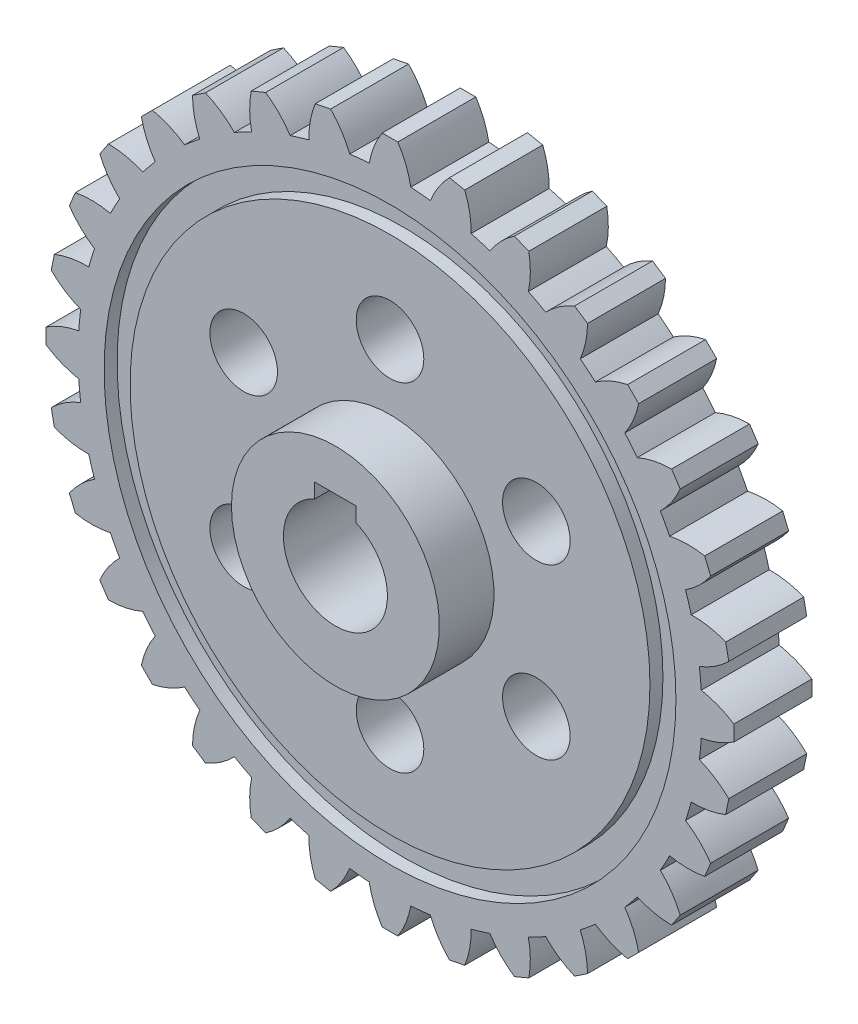
from build123d import *

# Parameters (mm, degrees)
SKETCH1_R           = 60
BOSS_EXTRUDE1_DEPTH = 15
SKETCH2_R           = 6.5
CUT_EXTRUDE1_DEPTH  = 87.168439698
SKETCH3_R           = 20
BOSS_EXTRUDE2_DEPTH = 10.5
CUT_EXTRUDE2_DEPTH  = 89.601636554
SKETCH5_R           = 55
SKETCH5_R_2         = 50
CUT_EXTRUDE3_DEPTH  = 2.5
BOSS_EXTRUDE3_START = -15
BOSS_EXTRUDE3_DEPTH = 15


with BuildPart() as part:
    # Sketch1 → Boss-Extrude1 (new body)
    with BuildSketch(Plane.XY):
        Circle(SKETCH1_R)
    extrude(amount=BOSS_EXTRUDE1_DEPTH)

    # Sketch2 → Cut-Extrude1 (cut, through all)
    with BuildSketch(Plane.XY.offset(15)):
        with Locations((0, 32.5)):
            Circle(SKETCH2_R)
        with Locations((28.145825623, 16.25)):
            Circle(SKETCH2_R)
        with Locations((28.145825623, -16.25)):
            Circle(SKETCH2_R)
        with Locations((0, -32.5)):
            Circle(SKETCH2_R)
        with Locations((-28.145825623, -16.25)):
            Circle(SKETCH2_R)
        with Locations((-28.145825623, 16.25)):
            Circle(SKETCH2_R)
    extrude(amount=-CUT_EXTRUDE1_DEPTH, mode=Mode.SUBTRACT)

    # Sketch3 → Boss-Extrude2 (add)
    with BuildSketch(Plane.XY.offset(15)):
        with Locations(Location((0, 0, 0), (0, 0, 180))):
            Circle(SKETCH3_R)
    boss_extrude2 = extrude(amount=BOSS_EXTRUDE2_DEPTH)

    # Sketch4 → Cut-Extrude2 (cut, through all)
    with BuildSketch(Plane.XY.offset(25.5)):
        with BuildLine():
            Line((-4, 12), (4, 12))
            Line((4, 12), (4, 9.16515139))
            ThreePointArc((4, 9.16515139), (0, -10), (-4, 9.16515139))
            Line((-4, 9.16515139), (-4, 12))
        make_face()
    cut_extrude2 = extrude(amount=-CUT_EXTRUDE2_DEPTH, mode=Mode.SUBTRACT)

    # Sketch5 → Cut-Extrude3 (cut)
    with BuildSketch(Plane.XY.offset(15)):
        Circle(SKETCH5_R)
        Circle(SKETCH5_R_2, mode=Mode.SUBTRACT)
    cut_extrude3 = extrude(amount=-CUT_EXTRUDE3_DEPTH, mode=Mode.SUBTRACT)

    # Mirror1: Boss-Extrude2, Cut-Extrude2, Cut-Extrude3 across plane
    add(boss_extrude2.mirror(Plane.XY.offset(7.5)))
    add(cut_extrude2.mirror(Plane.XY.offset(7.5)), mode=Mode.SUBTRACT)
    add(cut_extrude3.mirror(Plane.XY.offset(7.5)), mode=Mode.SUBTRACT)

    # Sketch6 → Boss-Extrude3 (add)
    with BuildSketch(Plane.XY.offset(15).offset(BOSS_EXTRUDE3_START)):
        with BuildLine():
            Line((-1.5, 66.136518188), (1.5, 66.136518188))
            ThreePointArc((1.5, 66.136518188), (3.064324573, 63.126846965), (4, 59.866518188))
            ThreePointArc((4, 59.866518188), (0, 60), (-4, 59.866518188))
            ThreePointArc((-4, 59.866518188), (-3.064324573, 63.126846965), (-1.5, 66.136518188))
        make_face()
        with BuildLine():
            Line((11.43141671, 65.158359019), (14.373772551, 64.573088053))
            ThreePointArc((14.373772551, 64.573088053), (15.320881338, 61.316062234), (15.602519433, 57.93583854))
            ThreePointArc((15.602519433, 57.93583854), (11.705419321, 58.847116824), (7.75623719, 59.496561116))
            ThreePointArc((7.75623719, 59.496561116), (9.309992467, 62.51170237), (11.43141671, 65.158359019))
        make_face()
        with BuildLine():
            Line((23.923530486, 61.676200654), (26.695169084, 60.528150357))
            ThreePointArc((26.695169084, 60.528150357), (26.988665225, 57.148935618), (26.605442794, 53.778717108))
            ThreePointArc((26.605442794, 53.778717108), (22.961005942, 55.432771951), (19.214406534, 56.840184566))
            ThreePointArc((19.214406534, 56.840184566), (21.326531717, 59.494268109), (23.923530486, 61.676200654))
        make_face()
        with BuildLine():
            Line((35.496276403, 55.823860487), (37.990685239, 54.157149788))
            ThreePointArc((37.990685239, 54.157149788), (37.619289843, 50.785607455), (36.585933909, 47.554909736))
            ThreePointArc((36.585933909, 47.554909736), (33.334213981, 49.888176738), (29.934177011, 51.9994716))
            ThreePointArc((29.934177011, 51.9994716), (32.523504314, 54.190502489), (35.496276403, 55.823860487))
        make_face()
        with BuildLine():
            Line((45.704920323, 47.826240667), (47.826240667, 45.704920323))
            ThreePointArc((47.826240667, 45.704920323), (46.80422625, 42.470616879), (45.160448102, 39.503593852))
            ThreePointArc((45.160448102, 39.503593852), (42.426406871, 42.426406871), (39.503593852, 45.160448102))
            ThreePointArc((39.503593852, 45.160448102), (42.470616879, 46.804226249), (45.704920323, 47.826240667))
        make_face()
        with BuildLine():
            Line((54.157149788, 37.990685239), (55.823860487, 35.496276403))
            ThreePointArc((55.823860487, 35.496276403), (54.190502489, 32.523504314), (51.9994716, 29.934177011))
            ThreePointArc((51.9994716, 29.934177011), (49.888176738, 33.334213981), (47.554909736, 36.585933909))
            ThreePointArc((47.554909736, 36.585933909), (50.785607455, 37.619289843), (54.157149788, 37.990685239))
        make_face()
        with BuildLine():
            Line((60.528150357, 26.695169084), (61.676200654, 23.923530486))
            ThreePointArc((61.676200654, 23.923530486), (59.494268109, 21.326531717), (56.840184566, 19.214406534))
            ThreePointArc((56.840184566, 19.214406534), (55.432771951, 22.961005942), (53.778717108, 26.605442794))
            ThreePointArc((53.778717108, 26.605442794), (57.148935618, 26.988665225), (60.528150357, 26.695169084))
        make_face()
        with BuildLine():
            Line((64.573088053, 14.373772551), (65.158359019, 11.43141671))
            ThreePointArc((65.158359019, 11.43141671), (62.51170237, 9.309992467), (59.496561116, 7.75623719))
            ThreePointArc((59.496561116, 7.75623719), (58.847116824, 11.705419321), (57.93583854, 15.602519433))
            ThreePointArc((57.93583854, 15.602519433), (61.316062234, 15.320881338), (64.573088053, 14.373772551))
        make_face()
        with BuildLine():
            Line((66.136518188, 1.5), (66.136518188, -1.5))
            ThreePointArc((66.136518188, -1.5), (63.126846965, -3.064324573), (59.866518188, -4))
            ThreePointArc((59.866518188, -4), (60, 0), (59.866518188, 4))
            ThreePointArc((59.866518188, 4), (63.126846965, 3.064324573), (66.136518188, 1.5))
        make_face()
        with BuildLine():
            Line((65.158359019, -11.43141671), (64.573088053, -14.373772551))
            ThreePointArc((64.573088053, -14.373772551), (61.316062234, -15.320881338), (57.93583854, -15.602519433))
            ThreePointArc((57.93583854, -15.602519433), (58.847116824, -11.705419321), (59.496561116, -7.75623719))
            ThreePointArc((59.496561116, -7.75623719), (62.51170237, -9.309992467), (65.158359019, -11.43141671))
        make_face()
        with BuildLine():
            Line((61.676200654, -23.923530486), (60.528150357, -26.695169084))
            ThreePointArc((60.528150357, -26.695169084), (57.148935618, -26.988665225), (53.778717108, -26.605442794))
            ThreePointArc((53.778717108, -26.605442794), (55.432771951, -22.961005942), (56.840184566, -19.214406534))
            ThreePointArc((56.840184566, -19.214406534), (59.494268109, -21.326531717), (61.676200654, -23.923530486))
        make_face()
        with BuildLine():
            Line((55.823860487, -35.496276403), (54.157149788, -37.99068524))
            ThreePointArc((54.157149788, -37.99068524), (50.785607455, -37.619289843), (47.554909736, -36.585933909))
            ThreePointArc((47.554909736, -36.585933909), (49.888176738, -33.334213981), (51.9994716, -29.934177011))
            ThreePointArc((51.9994716, -29.934177011), (54.190502489, -32.523504314), (55.823860487, -35.496276403))
        make_face()
        with BuildLine():
            Line((47.826240667, -45.704920323), (45.704920323, -47.826240667))
            ThreePointArc((45.704920323, -47.826240667), (42.470616879, -46.80422625), (39.503593852, -45.160448102))
            ThreePointArc((39.503593852, -45.160448102), (42.426406871, -42.426406871), (45.160448102, -39.503593852))
            ThreePointArc((45.160448102, -39.503593852), (46.80422625, -42.470616879), (47.826240667, -45.704920323))
        make_face()
        with BuildLine():
            Line((37.990685239, -54.157149788), (35.496276403, -55.823860487))
            ThreePointArc((35.496276403, -55.823860487), (32.523504314, -54.190502489), (29.934177011, -51.9994716))
            ThreePointArc((29.934177011, -51.9994716), (33.334213981, -49.888176738), (36.585933909, -47.554909736))
            ThreePointArc((36.585933909, -47.554909736), (37.619289843, -50.785607455), (37.990685239, -54.157149788))
        make_face()
        with BuildLine():
            Line((26.695169084, -60.528150357), (23.923530486, -61.676200654))
            ThreePointArc((23.923530486, -61.676200654), (21.326531717, -59.494268109), (19.214406534, -56.840184566))
            ThreePointArc((19.214406534, -56.840184566), (22.961005942, -55.432771951), (26.605442794, -53.778717108))
            ThreePointArc((26.605442794, -53.778717108), (26.988665225, -57.148935618), (26.695169084, -60.528150357))
        make_face()
        with BuildLine():
            Line((14.373772551, -64.573088053), (11.43141671, -65.158359019))
            ThreePointArc((11.43141671, -65.158359019), (9.309992467, -62.51170237), (7.75623719, -59.496561116))
            ThreePointArc((7.75623719, -59.496561116), (11.705419321, -58.847116824), (15.602519433, -57.93583854))
            ThreePointArc((15.602519433, -57.93583854), (15.320881338, -61.316062234), (14.373772551, -64.573088053))
        make_face()
        with BuildLine():
            Line((1.5, -66.136518188), (-1.5, -66.136518188))
            ThreePointArc((-1.5, -66.136518188), (-3.064324573, -63.126846966), (-4, -59.866518188))
            ThreePointArc((-4, -59.866518188), (0, -60), (4, -59.866518188))
            ThreePointArc((4, -59.866518188), (3.064324573, -63.126846966), (1.5, -66.136518188))
        make_face()
        with BuildLine():
            Line((-11.43141671, -65.158359019), (-14.373772551, -64.573088053))
            ThreePointArc((-14.373772551, -64.573088053), (-15.320881338, -61.316062234), (-15.602519433, -57.93583854))
            ThreePointArc((-15.602519433, -57.93583854), (-11.705419321, -58.847116824), (-7.75623719, -59.496561116))
            ThreePointArc((-7.75623719, -59.496561116), (-9.309992467, -62.51170237), (-11.43141671, -65.158359019))
        make_face()
        with BuildLine():
            Line((-23.923530486, -61.676200654), (-26.695169084, -60.528150357))
            ThreePointArc((-26.695169084, -60.528150357), (-26.988665225, -57.148935618), (-26.605442794, -53.778717108))
            ThreePointArc((-26.605442794, -53.778717108), (-22.961005942, -55.432771951), (-19.214406534, -56.840184566))
            ThreePointArc((-19.214406534, -56.840184566), (-21.326531717, -59.494268109), (-23.923530486, -61.676200654))
        make_face()
        with BuildLine():
            Line((-35.496276403, -55.823860487), (-37.990685239, -54.157149788))
            ThreePointArc((-37.990685239, -54.157149788), (-37.619289843, -50.785607455), (-36.585933909, -47.554909736))
            ThreePointArc((-36.585933909, -47.554909736), (-33.334213981, -49.888176738), (-29.934177011, -51.9994716))
            ThreePointArc((-29.934177011, -51.9994716), (-32.523504314, -54.190502489), (-35.496276403, -55.823860487))
        make_face()
        with BuildLine():
            Line((-45.704920323, -47.826240667), (-47.826240667, -45.704920323))
            ThreePointArc((-47.826240667, -45.704920323), (-46.80422625, -42.470616879), (-45.160448102, -39.503593852))
            ThreePointArc((-45.160448102, -39.503593852), (-42.426406871, -42.426406871), (-39.503593852, -45.160448102))
            ThreePointArc((-39.503593852, -45.160448102), (-42.470616879, -46.80422625), (-45.704920323, -47.826240667))
        make_face()
        with BuildLine():
            Line((-54.157149788, -37.99068524), (-55.823860487, -35.496276403))
            ThreePointArc((-55.823860487, -35.496276403), (-54.190502489, -32.523504314), (-51.9994716, -29.934177011))
            ThreePointArc((-51.9994716, -29.934177011), (-49.888176738, -33.334213981), (-47.554909736, -36.585933909))
            ThreePointArc((-47.554909736, -36.585933909), (-50.785607455, -37.619289843), (-54.157149788, -37.99068524))
        make_face()
        with BuildLine():
            Line((-60.528150357, -26.695169084), (-61.676200654, -23.923530486))
            ThreePointArc((-61.676200654, -23.923530486), (-59.494268109, -21.326531717), (-56.840184566, -19.214406534))
            ThreePointArc((-56.840184566, -19.214406534), (-55.432771951, -22.961005942), (-53.778717108, -26.605442794))
            ThreePointArc((-53.778717108, -26.605442794), (-57.148935618, -26.988665225), (-60.528150357, -26.695169084))
        make_face()
        with BuildLine():
            Line((-64.573088053, -14.373772551), (-65.158359019, -11.43141671))
            ThreePointArc((-65.158359019, -11.43141671), (-62.51170237, -9.309992467), (-59.496561116, -7.75623719))
            ThreePointArc((-59.496561116, -7.75623719), (-58.847116824, -11.705419321), (-57.93583854, -15.602519433))
            ThreePointArc((-57.93583854, -15.602519433), (-61.316062234, -15.320881338), (-64.573088053, -14.373772551))
        make_face()
        with BuildLine():
            Line((-66.136518188, -1.5), (-66.136518188, 1.5))
            ThreePointArc((-66.136518188, 1.5), (-63.126846965, 3.064324573), (-59.866518188, 4))
            ThreePointArc((-59.866518188, 4), (-60, 0), (-59.866518188, -4))
            ThreePointArc((-59.866518188, -4), (-63.126846965, -3.064324573), (-66.136518188, -1.5))
        make_face()
        with BuildLine():
            Line((-65.158359019, 11.43141671), (-64.573088053, 14.373772551))
            ThreePointArc((-64.573088053, 14.373772551), (-61.316062234, 15.320881338), (-57.93583854, 15.602519433))
            ThreePointArc((-57.93583854, 15.602519433), (-58.847116824, 11.705419321), (-59.496561116, 7.75623719))
            ThreePointArc((-59.496561116, 7.75623719), (-62.51170237, 9.309992467), (-65.158359019, 11.43141671))
        make_face()
        with BuildLine():
            Line((-61.676200654, 23.923530486), (-60.528150357, 26.695169084))
            ThreePointArc((-60.528150357, 26.695169084), (-57.148935618, 26.988665225), (-53.778717108, 26.605442794))
            ThreePointArc((-53.778717108, 26.605442794), (-55.432771951, 22.961005942), (-56.840184566, 19.214406534))
            ThreePointArc((-56.840184566, 19.214406534), (-59.494268109, 21.326531717), (-61.676200654, 23.923530486))
        make_face()
        with BuildLine():
            Line((-55.823860487, 35.496276403), (-54.157149788, 37.990685239))
            ThreePointArc((-54.157149788, 37.990685239), (-50.785607455, 37.619289843), (-47.554909736, 36.585933909))
            ThreePointArc((-47.554909736, 36.585933909), (-49.888176738, 33.334213981), (-51.9994716, 29.934177011))
            ThreePointArc((-51.9994716, 29.934177011), (-54.190502489, 32.523504314), (-55.823860487, 35.496276403))
        make_face()
        with BuildLine():
            Line((-47.826240667, 45.704920323), (-45.704920323, 47.826240667))
            ThreePointArc((-45.704920323, 47.826240667), (-42.470616879, 46.804226249), (-39.503593852, 45.160448102))
            ThreePointArc((-39.503593852, 45.160448102), (-42.426406871, 42.426406871), (-45.160448102, 39.503593852))
            ThreePointArc((-45.160448102, 39.503593852), (-46.80422625, 42.470616879), (-47.826240667, 45.704920323))
        make_face()
        with BuildLine():
            Line((-37.990685239, 54.157149788), (-35.496276403, 55.823860487))
            ThreePointArc((-35.496276403, 55.823860487), (-32.523504314, 54.190502489), (-29.934177011, 51.9994716))
            ThreePointArc((-29.934177011, 51.9994716), (-33.334213981, 49.888176738), (-36.585933909, 47.554909736))
            ThreePointArc((-36.585933909, 47.554909736), (-37.619289843, 50.785607455), (-37.990685239, 54.157149788))
        make_face()
        with BuildLine():
            Line((-26.695169084, 60.528150357), (-23.923530486, 61.676200654))
            ThreePointArc((-23.923530486, 61.676200654), (-21.326531717, 59.494268109), (-19.214406534, 56.840184566))
            ThreePointArc((-19.214406534, 56.840184566), (-22.961005942, 55.432771951), (-26.605442794, 53.778717108))
            ThreePointArc((-26.605442794, 53.778717108), (-26.988665225, 57.148935618), (-26.695169084, 60.528150357))
        make_face()
        with BuildLine():
            Line((-14.373772551, 64.573088053), (-11.43141671, 65.158359019))
            ThreePointArc((-11.43141671, 65.158359019), (-9.309992467, 62.51170237), (-7.75623719, 59.496561116))
            ThreePointArc((-7.75623719, 59.496561116), (-11.705419321, 58.847116824), (-15.602519433, 57.93583854))
            ThreePointArc((-15.602519433, 57.93583854), (-15.320881338, 61.316062234), (-14.373772551, 64.573088053))
        make_face()
    extrude(amount=BOSS_EXTRUDE3_DEPTH)


solid = part.part
